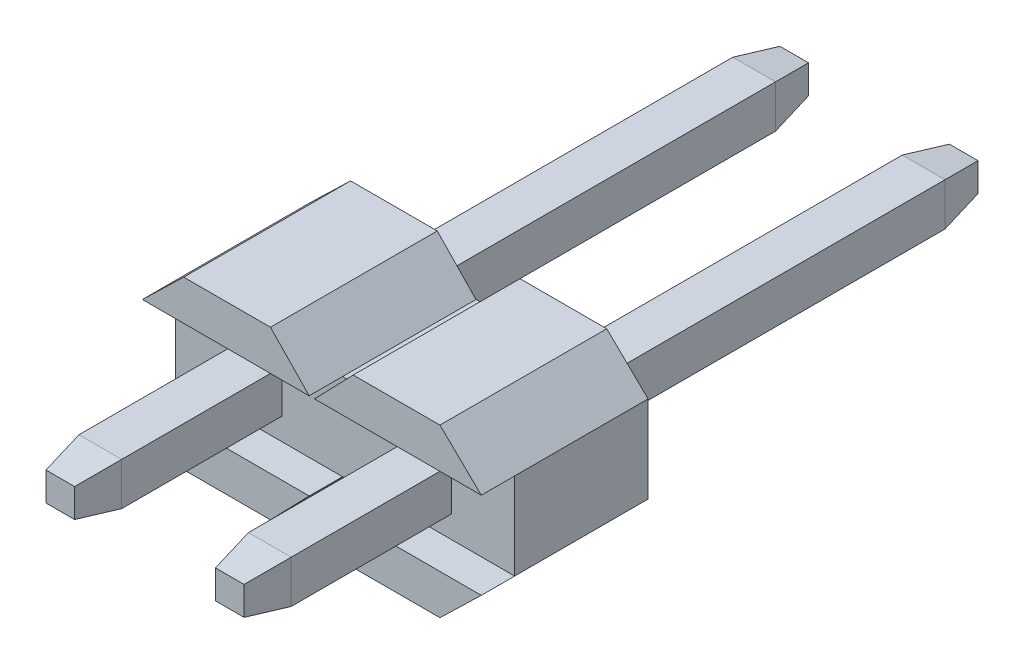
from build123d import *
from OCP.BRepFilletAPI import BRepFilletAPI_MakeChamfer

# Parameters (mm, degrees)
EXTRUDE_1_DEPTH     = 1.25
SKETCH_2_W          = 0.5
SKETCH_2_H          = 1.3
CUT_EXTRUDE_1_DEPTH = 6.378791686
SKETCH_3_W          = 0.64
SKETCH_3_H          = 0.64
EXTRUDE_2_DEPTH     = 6
EXTRUDE_START       = -2
SKETCH_3_2_W        = 0.64
SKETCH_3_2_H        = 0.64
EXTRUDE_3_DEPTH     = 3
CHAMFER_1_SIZE      = 0.6
CHAMFER_1_SIZE2     = 0.105796188


with BuildPart() as part:
    # 草图1 → 凸台-拉伸1 (new, symmetric)
    with BuildSketch(Plane.XY):
        Polygon((-1.92, 1.25), (-2.54, 0.65), (-2.54, -0.65), (-1.92, -1.25), (-0.62, -1.25), (-0.04, -0.65), (0.04, -0.65), (0.62, -1.25), (1.92, -1.25), (2.54, -0.65), (2.54, 0.65), (1.92, 1.25), (0.62, 1.25), (0.04, 0.65), (-0.04, 0.65), (-0.62, 1.25), align=None)
    extrude(amount=EXTRUDE_1_DEPTH, both=True)

    # 草图2 → 切除-拉伸1 (cut, through all)
    with BuildSketch(Plane.ZY.offset(2.54)):
        with Locations((1, 0)):
            Rectangle(SKETCH_2_W, SKETCH_2_H)
    extrude(amount=-CUT_EXTRUDE_1_DEPTH, mode=Mode.SUBTRACT)

    # 草图3 → 凸台-拉伸2 (add)
    with BuildSketch(Plane(origin=(0, 0, -1.25), x_dir=(-1, 0, 0), z_dir=(0, 0, -1))):
        with Locations((-1.27, 0)):
            Rectangle(SKETCH_3_W, SKETCH_3_H)
        with Locations((1.27, 0)):
            Rectangle(SKETCH_3_W, SKETCH_3_H)
    extrude(amount=EXTRUDE_2_DEPTH)

    # 草图3<2> → 凸台-拉伸3 (add)
    with BuildSketch(Plane(origin=(0, 0, -1.25), x_dir=(-1, 0, 0), z_dir=(0, 0, -1)).offset(EXTRUDE_START)):
        with Locations((-1.27, 0)):
            Rectangle(SKETCH_3_2_W, SKETCH_3_2_H)
        with Locations((1.27, 0)):
            Rectangle(SKETCH_3_2_W, SKETCH_3_2_H)
    extrude(amount=-EXTRUDE_3_DEPTH)

    # 倒角1: one chamfer whose edges measure the first distance from different faces: ONE call of the kernel's chamfer builder (chamfer() names one face for all edges)
    chamfer_1_edges_1 = [part.edges().sort_by_distance(p)[0] for p in [
        (-1.59, 0, 3.75),
    ]]
    chamfer_1_side_1 = [part.faces().sort_by_distance(p)[0] for p in [
        (-1.59, 0, 2.25),
    ]]
    chamfer_1_edges_2 = [part.edges().sort_by_distance(p)[0] for p in [
        (-1.27, -0.32, 3.75),
    ]]
    chamfer_1_side_2 = [part.faces().sort_by_distance(p)[0] for p in [
        (-1.27, -0.32, 2.25),
    ]]
    chamfer_1_edges_3 = [part.edges().sort_by_distance(p)[0] for p in [
        (-0.95, 0, 3.75),
    ]]
    chamfer_1_side_3 = [part.faces().sort_by_distance(p)[0] for p in [
        (-0.95, 0, 2.25),
    ]]
    chamfer_1_edges_4 = [part.edges().sort_by_distance(p)[0] for p in [
        (-1.27, 0.32, 3.75),
    ]]
    chamfer_1_side_4 = [part.faces().sort_by_distance(p)[0] for p in [
        (-1.27, 0.32, 2.25),
    ]]
    chamfer_1_edges_5 = [part.edges().sort_by_distance(p)[0] for p in [
        (1.59, 0, -7.25),
    ]]
    chamfer_1_side_5 = [part.faces().sort_by_distance(p)[0] for p in [
        (1.59, 0, -4.25),
    ]]
    chamfer_1_edges_6 = [part.edges().sort_by_distance(p)[0] for p in [
        (1.27, -0.32, -7.25),
    ]]
    chamfer_1_side_6 = [part.faces().sort_by_distance(p)[0] for p in [
        (1.27, -0.32, -4.25),
    ]]
    chamfer_1_edges_7 = [part.edges().sort_by_distance(p)[0] for p in [
        (0.95, 0, -7.25),
    ]]
    chamfer_1_side_7 = [part.faces().sort_by_distance(p)[0] for p in [
        (0.95, 0, -4.25),
    ]]
    chamfer_1_edges_8 = [part.edges().sort_by_distance(p)[0] for p in [
        (1.27, 0.32, -7.25),
    ]]
    chamfer_1_side_8 = [part.faces().sort_by_distance(p)[0] for p in [
        (1.27, 0.32, -4.25),
    ]]
    chamfer_1_edges_9 = [part.edges().sort_by_distance(p)[0] for p in [
        (-1.59, 0, -7.25),
    ]]
    chamfer_1_side_9 = [part.faces().sort_by_distance(p)[0] for p in [
        (-1.59, 0, -4.25),
    ]]
    chamfer_1_edges_10 = [part.edges().sort_by_distance(p)[0] for p in [
        (-1.27, 0.32, -7.25),
    ]]
    chamfer_1_side_10 = [part.faces().sort_by_distance(p)[0] for p in [
        (-1.27, 0.32, -4.25),
    ]]
    chamfer_1_edges_11 = [part.edges().sort_by_distance(p)[0] for p in [
        (-0.95, 0, -7.25),
    ]]
    chamfer_1_side_11 = [part.faces().sort_by_distance(p)[0] for p in [
        (-0.95, 0, -4.25),
    ]]
    chamfer_1_edges_12 = [part.edges().sort_by_distance(p)[0] for p in [
        (-1.27, -0.32, -7.25),
    ]]
    chamfer_1_side_12 = [part.faces().sort_by_distance(p)[0] for p in [
        (-1.27, -0.32, -4.25),
    ]]
    chamfer_1_edges_13 = [part.edges().sort_by_distance(p)[0] for p in [
        (1.59, 0, 3.75),
    ]]
    chamfer_1_side_13 = [part.faces().sort_by_distance(p)[0] for p in [
        (1.59, 0, 2.25),
    ]]
    chamfer_1_edges_14 = [part.edges().sort_by_distance(p)[0] for p in [
        (1.27, 0.32, 3.75),
    ]]
    chamfer_1_side_14 = [part.faces().sort_by_distance(p)[0] for p in [
        (1.27, 0.32, 2.25),
    ]]
    chamfer_1_edges_15 = [part.edges().sort_by_distance(p)[0] for p in [
        (0.95, 0, 3.75),
    ]]
    chamfer_1_side_15 = [part.faces().sort_by_distance(p)[0] for p in [
        (0.95, 0, 2.25),
    ]]
    chamfer_1_edges_16 = [part.edges().sort_by_distance(p)[0] for p in [
        (1.27, -0.32, 3.75),
    ]]
    chamfer_1_side_16 = [part.faces().sort_by_distance(p)[0] for p in [
        (1.27, -0.32, 2.25),
    ]]
    chamfer_1 = BRepFilletAPI_MakeChamfer(part.part.solid().wrapped)
    for e in chamfer_1_edges_1:
        chamfer_1.Add(CHAMFER_1_SIZE, CHAMFER_1_SIZE2, e.wrapped, chamfer_1_side_1[0].wrapped)  # the first distance lies on this face
    for e in chamfer_1_edges_2:
        chamfer_1.Add(CHAMFER_1_SIZE, CHAMFER_1_SIZE2, e.wrapped, chamfer_1_side_2[0].wrapped)  # the first distance lies on this face
    for e in chamfer_1_edges_3:
        chamfer_1.Add(CHAMFER_1_SIZE, CHAMFER_1_SIZE2, e.wrapped, chamfer_1_side_3[0].wrapped)  # the first distance lies on this face
    for e in chamfer_1_edges_4:
        chamfer_1.Add(CHAMFER_1_SIZE, CHAMFER_1_SIZE2, e.wrapped, chamfer_1_side_4[0].wrapped)  # the first distance lies on this face
    for e in chamfer_1_edges_5:
        chamfer_1.Add(CHAMFER_1_SIZE, CHAMFER_1_SIZE2, e.wrapped, chamfer_1_side_5[0].wrapped)  # the first distance lies on this face
    for e in chamfer_1_edges_6:
        chamfer_1.Add(CHAMFER_1_SIZE, CHAMFER_1_SIZE2, e.wrapped, chamfer_1_side_6[0].wrapped)  # the first distance lies on this face
    for e in chamfer_1_edges_7:
        chamfer_1.Add(CHAMFER_1_SIZE, CHAMFER_1_SIZE2, e.wrapped, chamfer_1_side_7[0].wrapped)  # the first distance lies on this face
    for e in chamfer_1_edges_8:
        chamfer_1.Add(CHAMFER_1_SIZE, CHAMFER_1_SIZE2, e.wrapped, chamfer_1_side_8[0].wrapped)  # the first distance lies on this face
    for e in chamfer_1_edges_9:
        chamfer_1.Add(CHAMFER_1_SIZE, CHAMFER_1_SIZE2, e.wrapped, chamfer_1_side_9[0].wrapped)  # the first distance lies on this face
    for e in chamfer_1_edges_10:
        chamfer_1.Add(CHAMFER_1_SIZE, CHAMFER_1_SIZE2, e.wrapped, chamfer_1_side_10[0].wrapped)  # the first distance lies on this face
    for e in chamfer_1_edges_11:
        chamfer_1.Add(CHAMFER_1_SIZE, CHAMFER_1_SIZE2, e.wrapped, chamfer_1_side_11[0].wrapped)  # the first distance lies on this face
    for e in chamfer_1_edges_12:
        chamfer_1.Add(CHAMFER_1_SIZE, CHAMFER_1_SIZE2, e.wrapped, chamfer_1_side_12[0].wrapped)  # the first distance lies on this face
    for e in chamfer_1_edges_13:
        chamfer_1.Add(CHAMFER_1_SIZE, CHAMFER_1_SIZE2, e.wrapped, chamfer_1_side_13[0].wrapped)  # the first distance lies on this face
    for e in chamfer_1_edges_14:
        chamfer_1.Add(CHAMFER_1_SIZE, CHAMFER_1_SIZE2, e.wrapped, chamfer_1_side_14[0].wrapped)  # the first distance lies on this face
    for e in chamfer_1_edges_15:
        chamfer_1.Add(CHAMFER_1_SIZE, CHAMFER_1_SIZE2, e.wrapped, chamfer_1_side_15[0].wrapped)  # the first distance lies on this face
    for e in chamfer_1_edges_16:
        chamfer_1.Add(CHAMFER_1_SIZE, CHAMFER_1_SIZE2, e.wrapped, chamfer_1_side_16[0].wrapped)  # the first distance lies on this face
    add(Compound.cast(chamfer_1.Shape()), mode=Mode.REPLACE)


solid = part.part
